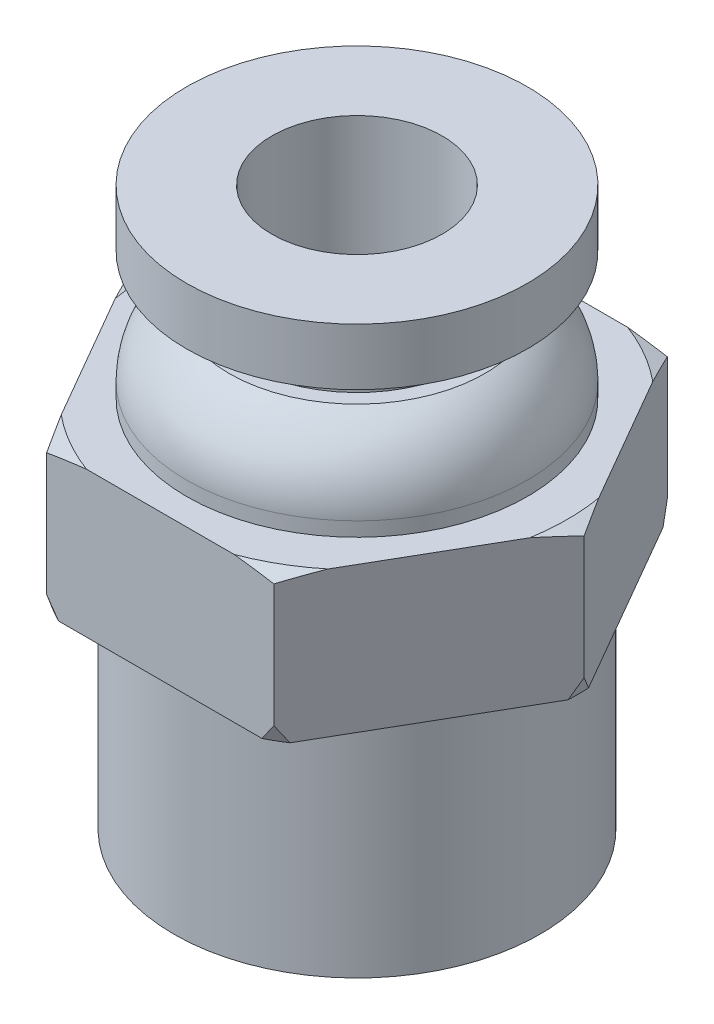
from build123d import *
from OCP.BRepFilletAPI import BRepFilletAPI_MakeChamfer

# Parameters (mm, degrees)
CHAMFER_1_SIZE      = 0.2
CHAMFER_1_SIZE2     = 0.6
CUT_EXTRUDE_1_DEPTH = 6.622206177
SKETCH_3_R          = 13
CUT_EXTRUDE_3_DEPTH = 23.650187091


with BuildPart() as part:
    # 草图1 → 旋转1 (revolve)
    with BuildSketch(Plane.XY, mode=Mode.PRIVATE) as revolve_1_sk:
        with BuildLine():
            Line((6, 19.622206177), (3, 19.622206177))
            Line((3, 19.622206177), (3, 6.622206177))
            Line((3, 6.622206177), (0, 6.622206177))
            Line((0, 6.622206177), (0, 3))
            Line((0, 3), (5.45, 3))
            Line((5.45, 3), (5.45, 0))
            Line((5.45, 0), (6.45, 0))
            Line((6.45, 0), (6.45, 8))
            Line((6.45, 8), (8, 8))
            Line((8, 8), (8, 13.122206177))
            Line((8, 13.122206177), (6, 13.122206177))
            Line((6, 13.122206177), (6, 13.622206177))
            ThreePointArc((6, 13.622206177), (5.596229956, 15.079944151), (4.5, 16.122206177))
            Line((4.5, 16.122206177), (4, 16.122206177))
            Line((4, 16.122206177), (4, 16.622206177))
            Line((4, 16.622206177), (3.5, 16.622206177))
            Line((3.5, 16.622206177), (3.5, 17.622206177))
            Line((3.5, 17.622206177), (6, 17.622206177))
            Line((6, 17.622206177), (6, 19.622206177))
        make_face()
    revolve(revolve_1_sk.sketch.rotate(Axis((0, 26.759420291, 0), (0, -1, 0)), 90), axis=Axis((0, 26.759420291, 0), (0, -1, 0)))

    # 倒角1: one chamfer whose edges measure the first distance from different faces: ONE call of the kernel's chamfer builder (chamfer() names one face for all edges)
    chamfer_1_edges_1 = [part.edges().sort_by_distance(p)[0] for p in [
        (0, 13.122206177, -8),
    ]]
    chamfer_1_side_1 = [part.faces().sort_by_distance(p)[0] for p in [
        (0, 10.561103089, -8),
    ]]
    chamfer_1_edges_2 = [part.edges().sort_by_distance(p)[0] for p in [
        (0, 8, -8),
    ]]
    chamfer_1_side_2 = [part.faces().sort_by_distance(p)[0] for p in [
        (0, 8, -6.67627417),
    ]]
    chamfer_1 = BRepFilletAPI_MakeChamfer(part.part.solid().wrapped)
    for e in chamfer_1_edges_1:
        chamfer_1.Add(CHAMFER_1_SIZE, CHAMFER_1_SIZE2, e.wrapped, chamfer_1_side_1[0].wrapped)  # the first distance lies on this face
    for e in chamfer_1_edges_2:
        chamfer_1.Add(CHAMFER_1_SIZE, CHAMFER_1_SIZE2, e.wrapped, chamfer_1_side_2[0].wrapped)  # the first distance lies on this face
    add(Compound.cast(chamfer_1.Shape()), mode=Mode.REPLACE)

    # 草图2 → 切除-拉伸1 (cut)
    with BuildSketch(Plane(origin=(0, 0, 0), x_dir=(1, 0, 0), z_dir=(0, 1, 0))):
        Polygon((2, 1.154700538), (0, 2.309401077), (-2, 1.154700538), (-2, -1.154700538), (0, -2.309401077), (2, -1.154700538), align=None)
    extrude(amount=CUT_EXTRUDE_1_DEPTH, mode=Mode.SUBTRACT)

    # 草图3 → 切除-拉伸3 (cut, through all)
    with BuildSketch(Plane(origin=(0, 0, 0), x_dir=(1, 0, 0), z_dir=(0, 1, 0))):
        Circle(SKETCH_3_R)
        Polygon((8, 0), (4, 6.92820323), (-4, 6.92820323), (-8, 0), (-4, -6.92820323), (4, -6.92820323), align=None, mode=Mode.SUBTRACT)
    extrude(amount=CUT_EXTRUDE_3_DEPTH, mode=Mode.SUBTRACT)


solid = part.part
